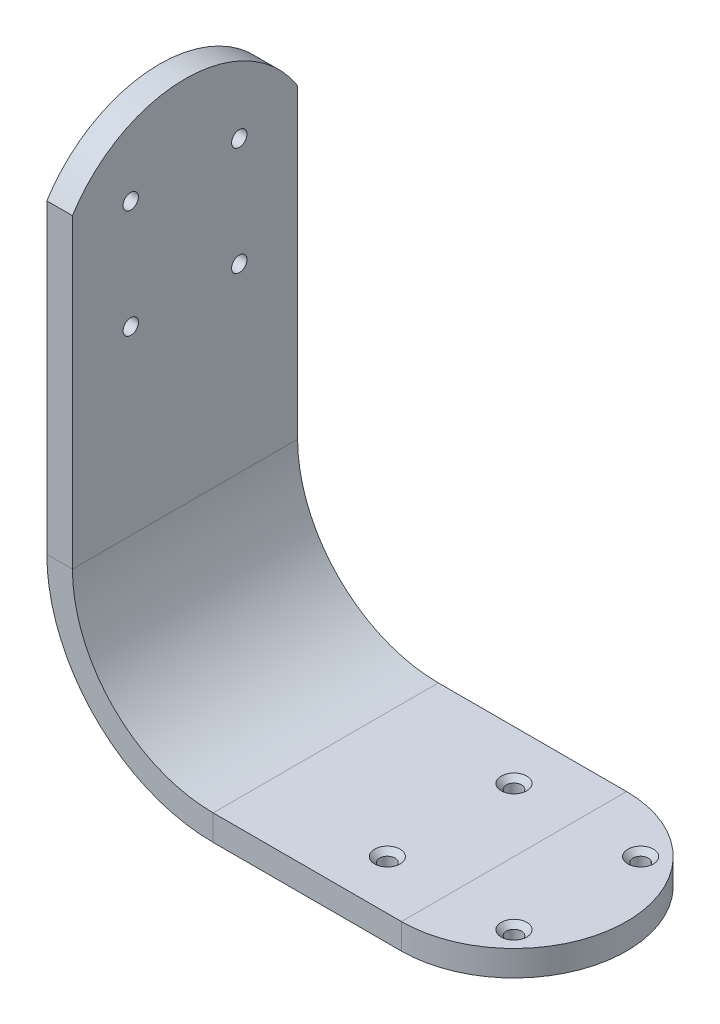
from build123d import *

# Parameters (mm, degrees)
SKETCH_2_W                   = 5
SKETCH_2_H                   = 44
CUT_EXTRUDE_1_DEPTH          = 136.500823221
CUT_EXTRUDE_2_DEPTH          = 112.990773585
HOLE_WIZARD_M31_D            = 3
HOLE_WIZARD_M31_CSINK_D      = 5
HOLE_WIZARD_M31_CSINK_ANGLE  = 90
HOLE_WIZARD_M31_2_AT_2_COUNT = 2
HOLE_WIZARD_M31_2_AT_2_PITCH = 21.213203436
HOLE_WIZARD_M31_2_AT_3_COUNT = 2
HOLE_WIZARD_M31_2_AT_3_PITCH = 21.213203436
HOLE_WIZARD_M31_2_AT_4_COUNT = 2
HOLE_WIZARD_M31_2_AT_4_PITCH = 30


with BuildPart() as part:
    # По траектории1: sweep along a path in Эскиз1
    with BuildLine(Plane.XY) as sweep_1_path:
        Line((0, 43.940273354), (0, -28.521737175))
        ThreePointArc((0, -28.521737175), (8.786796564, -49.734940611), (30, -58.521737175))
        Line((30, -58.521737175), (66.792283136, -58.521737175))
        Line((66.792283136, -58.521737175), (88.792283136, -58.521737175))
    # Эскиз2 → По траектории1 (sweep)
    with BuildSketch(Plane(origin=(0, 0, 0), x_dir=(1, 0, 0), z_dir=(0, 1, 0))):
        Rectangle(SKETCH_2_W, SKETCH_2_H)
    sweep(path=sweep_1_path.line)

    # Эскиз3 → Вырез-Вытянуть1 (cut, through all)
    with BuildSketch(Plane(origin=(0, -56.021737175, 0), x_dir=(1, 0, 0), z_dir=(0, 1, 0))):
        with BuildLine():
            Line((88.792283136, 22), (66.792283136, 22))
            ThreePointArc((66.792283136, 22), (82.348632323, 15.556349186), (88.792283136, 0))
            Line((88.792283136, 0), (88.792283136, 22))
        make_face()
        with BuildLine():
            Line((88.792283136, -22), (88.792283136, 0))
            ThreePointArc((88.792283136, 0), (82.348632323, -15.556349186), (66.792283136, -22))
            Line((66.792283136, -22), (88.792283136, -22))
        make_face()
    extrude(amount=-CUT_EXTRUDE_1_DEPTH, mode=Mode.SUBTRACT)

    # Эскиз4 → Вырез-Вытянуть2 (cut, through all)
    with BuildSketch(Plane.ZY.offset(2.5)):
        with BuildLine():
            Line((22, 43.940273354), (-22, 43.940273354))
            Line((-22, 43.940273354), (-22, 31.296679815))
            ThreePointArc((-22, 31.296679815), (0, 43.440273354), (22, 31.296679815))
            Line((22, 31.296679815), (22, 43.940273354))
        make_face()
    extrude(amount=-CUT_EXTRUDE_2_DEPTH, mode=Mode.SUBTRACT)

    # Hole Wizard M31 (through all)
    with Locations(Plane(origin=(0, -56.021737175, 0), x_dir=(1, 0, 0), z_dir=(0, 1, 0))):
        with Locations((54.417914466, -12.374368671), (79.166651807, -12.374368671), (79.166651807, 12.374368671), (54.417914466, 12.374368671)):
            CounterSinkHole(HOLE_WIZARD_M31_D / 2, HOLE_WIZARD_M31_CSINK_D / 2, counter_sink_angle=HOLE_WIZARD_M31_CSINK_ANGLE)

    # Эскиз10 → Hole Wizard M31 2 (revolve, cut)
    with BuildSketch(Plane(origin=(-2.5, 28.046875072, -10.606601718), x_dir=(0, 0, 1), z_dir=(0, 1, 0))):
        Polygon((0, 0), (0, 91.292283136), (1.5, 91.292283136), (1.5, 1.5), (2.75, 1.5), (2.75, 0.525), (3.275, 0), align=None)
    hole_wizard_m31_2 = revolve(axis=Axis((-8.85, 28.046875072, -10.606601718), (1, 0, 0)), mode=Mode.SUBTRACT)

    # Hole Wizard M31 2 at 2: Hole Wizard M31 2 ×2
    with Locations(*[(0, 0, i * HOLE_WIZARD_M31_2_AT_2_PITCH) for i in range(1, HOLE_WIZARD_M31_2_AT_2_COUNT)]):
        add(hole_wizard_m31_2, mode=Mode.SUBTRACT)

    # Hole Wizard M31 2 at 3: Hole Wizard M31 2 ×2
    with Locations(*[(0, -i * HOLE_WIZARD_M31_2_AT_3_PITCH, 0) for i in range(1, HOLE_WIZARD_M31_2_AT_3_COUNT)]):
        add(hole_wizard_m31_2, mode=Mode.SUBTRACT)

    # Hole Wizard M31 2 at 4: Hole Wizard M31 2 ×2
    with Locations(*[Vector(0, -0.7071067811865492, 0.7071067811865459) * (i * HOLE_WIZARD_M31_2_AT_4_PITCH) for i in range(1, HOLE_WIZARD_M31_2_AT_4_COUNT)]):
        add(hole_wizard_m31_2, mode=Mode.SUBTRACT)


solid = part.part
